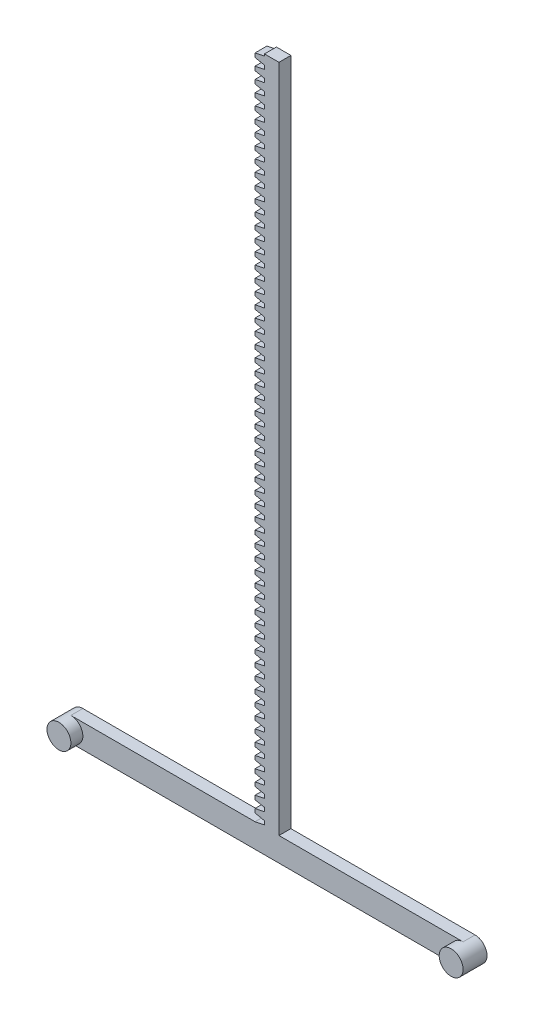
from build123d import *

# Parameters (mm, degrees)
BOSS_EXTRUDE1_DEPTH = 3.175
SKETCH2_R           = 3.175
BOSS_EXTRUDE2_DEPTH = 6.35
CUT_EXTRUDE1_DEPTH  = 3.175
LPATTERN1_COUNT     = 65
LPATTERN1_PITCH     = 3.048


with BuildPart() as part:
    # Sketch1 → Boss-Extrude1 (new body)
    with BuildSketch(Plane.XY):
        with BuildLine():
            Line((-52.07, 3.624292453), (-3.175, 3.624292453))
            Line((-3.175, 3.624292453), (-3.175, 181.424292453))
            Line((-3.175, 181.424292453), (3.175, 181.424292453))
            Line((3.175, 181.424292453), (3.175, 3.624292453))
            Line((3.175, 3.624292453), (52.07, 3.624292453))
            ThreePointArc((52.07, 3.624292453), (55.245, 0.449292453), (52.07, -2.725707547))
            Line((52.07, -2.725707547), (-52.07, -2.725707547))
            ThreePointArc((-52.07, -2.725707547), (-55.245, 0.449292453), (-52.07, 3.624292453))
        make_face()
    extrude(amount=BOSS_EXTRUDE1_DEPTH)

    # Sketch2 → Boss-Extrude2 (add)
    with BuildSketch(Plane.XY):
        with Locations(Location((52.07, 0.449292453, 0), (0, 0, 90))):
            Circle(SKETCH2_R)
        with Locations(Location((-52.07, 0.449292453, 0), (0, 0, 270))):
            Circle(SKETCH2_R)
    extrude(amount=BOSS_EXTRUDE2_DEPTH)

    # Sketch4 → Cut-Extrude1 (cut)
    with BuildSketch(Plane.XY.offset(3.175)):
        Polygon((-3.175, 3.624292453), (-3.175, 5.624292453), (-0.675, 5.124292453), (-0.675, 4.124292453), align=None)
    cut_extrude1 = extrude(amount=-CUT_EXTRUDE1_DEPTH, mode=Mode.SUBTRACT)

    # LPattern1: Cut-Extrude1 ×65
    with Locations(*[(0, i * LPATTERN1_PITCH, 0) for i in range(1, LPATTERN1_COUNT)]):
        add(cut_extrude1, mode=Mode.SUBTRACT)


solid = part.part
